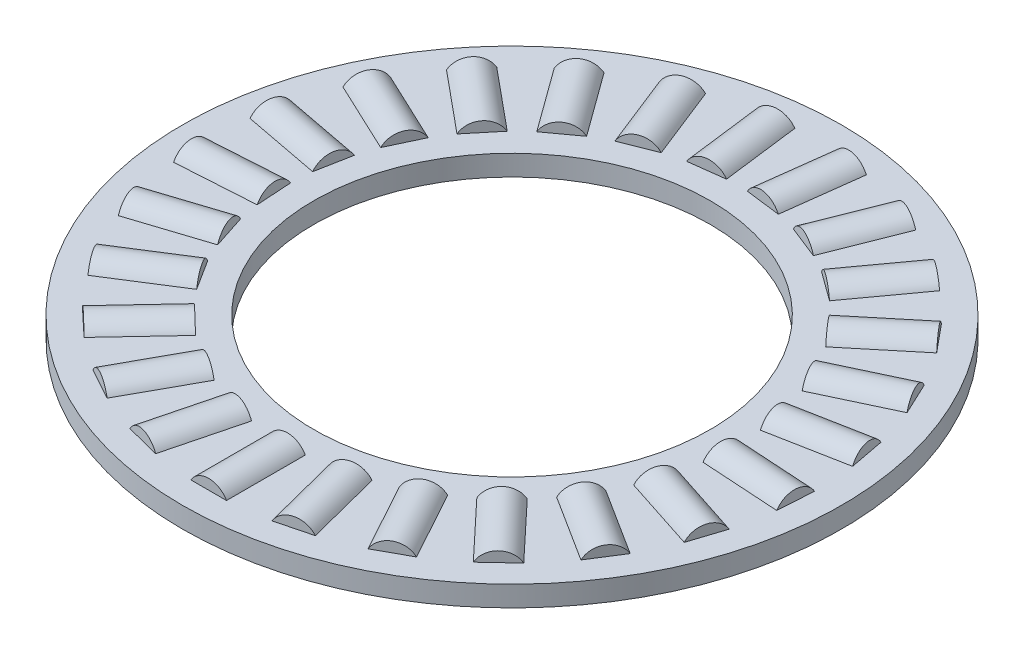
from build123d import *

# Parameters (mm, degrees)
SKETCH5_W         = 6.3246
SKETCH5_H         = 0.9921875
SKETCH3_W         = 3.79476
SKETCH3_H         = 0.9921875
SKETCH2_W         = 3.79476
SKETCH2_H         = 0.9921875
CIRPATTERN1_COUNT = 25
CIRPATTERN1_ANGLE = 345.6
CIRPATTERN2_COUNT = 25


with BuildPart() as part:
    # Sketch5 → Revolve3 (revolve)
    with BuildSketch(Plane(origin=(0, 0, 0), x_dir=(0, 0, -1), z_dir=(1, 0, 0)), mode=Mode.PRIVATE) as revolve3_sk:
        with Locations((-12.7127, 0)):
            Rectangle(SKETCH5_W, SKETCH5_H)
    revolve(revolve3_sk.sketch.rotate(Axis((0, -0.9921875, 0), (0, 1, 0)), 180), axis=Axis((0, -0.9921875, 0), (0, 1, 0)))

    # Sketch3 → Cut-Revolve1 (revolve, cut)
    with BuildSketch(Plane(origin=(0, 0, 0), x_dir=(0, 0, -1), z_dir=(1, 0, 0))):
        with Locations((-12.7127, 0.49609375)):
            Rectangle(SKETCH3_W, SKETCH3_H)
    cut_revolve1 = revolve(axis=Axis((0, 0, 14.61008), (0, 0, -1)), mode=Mode.SUBTRACT)

    # CirPattern2: Cut-Revolve1 ×25 about axis
    cirpattern2_axis = Axis((0, 0, 0), (0, 1, 0))
    for i in range(1, CIRPATTERN2_COUNT):
        add(cut_revolve1.rotate(cirpattern2_axis, i * 360 / CIRPATTERN2_COUNT), mode=Mode.SUBTRACT)


with BuildPart() as body_2:
    # Sketch2 → Revolve2 (revolve)
    with BuildSketch(Plane(origin=(0, 0, 0), x_dir=(0, 0, -1), z_dir=(1, 0, 0)), mode=Mode.PRIVATE) as revolve2_sk:
        with Locations((-12.7127, 0.49609375)):
            Rectangle(SKETCH2_W, SKETCH2_H)
    revolve(revolve2_sk.sketch.rotate(Axis((0, 0, 14.61008), (0, 0, -1)), 90), axis=Axis((0, 0, 14.61008), (0, 0, -1)))


with BuildPart() as cirpattern1_1:
    # CirPattern1: pattern copy
    add(body_2.part.rotate(Axis((0, 0.9921875, 0), (0, -1, 0)), 1 * CIRPATTERN1_ANGLE / (CIRPATTERN1_COUNT - 1)))


with BuildPart() as cirpattern1_2:
    # CirPattern1: pattern copy
    add(body_2.part.rotate(Axis((0, 0.9921875, 0), (0, -1, 0)), 2 * CIRPATTERN1_ANGLE / (CIRPATTERN1_COUNT - 1)))


with BuildPart() as cirpattern1_3:
    # CirPattern1: pattern copy
    add(body_2.part.rotate(Axis((0, 0.9921875, 0), (0, -1, 0)), 3 * CIRPATTERN1_ANGLE / (CIRPATTERN1_COUNT - 1)))


with BuildPart() as cirpattern1_4:
    # CirPattern1: pattern copy
    add(body_2.part.rotate(Axis((0, 0.9921875, 0), (0, -1, 0)), 4 * CIRPATTERN1_ANGLE / (CIRPATTERN1_COUNT - 1)))


with BuildPart() as cirpattern1_5:
    # CirPattern1: pattern copy
    add(body_2.part.rotate(Axis((0, 0.9921875, 0), (0, -1, 0)), 5 * CIRPATTERN1_ANGLE / (CIRPATTERN1_COUNT - 1)))


with BuildPart() as cirpattern1_6:
    # CirPattern1: pattern copy
    add(body_2.part.rotate(Axis((0, 0.9921875, 0), (0, -1, 0)), 6 * CIRPATTERN1_ANGLE / (CIRPATTERN1_COUNT - 1)))


with BuildPart() as cirpattern1_7:
    # CirPattern1: pattern copy
    add(body_2.part.rotate(Axis((0, 0.9921875, 0), (0, -1, 0)), 7 * CIRPATTERN1_ANGLE / (CIRPATTERN1_COUNT - 1)))


with BuildPart() as cirpattern1_8:
    # CirPattern1: pattern copy
    add(body_2.part.rotate(Axis((0, 0.9921875, 0), (0, -1, 0)), 8 * CIRPATTERN1_ANGLE / (CIRPATTERN1_COUNT - 1)))


with BuildPart() as cirpattern1_9:
    # CirPattern1: pattern copy
    add(body_2.part.rotate(Axis((0, 0.9921875, 0), (0, -1, 0)), 9 * CIRPATTERN1_ANGLE / (CIRPATTERN1_COUNT - 1)))


with BuildPart() as cirpattern1_10:
    # CirPattern1: pattern copy
    add(body_2.part.rotate(Axis((0, 0.9921875, 0), (0, -1, 0)), 10 * CIRPATTERN1_ANGLE / (CIRPATTERN1_COUNT - 1)))


with BuildPart() as cirpattern1_11:
    # CirPattern1: pattern copy
    add(body_2.part.rotate(Axis((0, 0.9921875, 0), (0, -1, 0)), 11 * CIRPATTERN1_ANGLE / (CIRPATTERN1_COUNT - 1)))


with BuildPart() as cirpattern1_12:
    # CirPattern1: pattern copy
    add(body_2.part.rotate(Axis((0, 0.9921875, 0), (0, -1, 0)), 12 * CIRPATTERN1_ANGLE / (CIRPATTERN1_COUNT - 1)))


with BuildPart() as cirpattern1_13:
    # CirPattern1: pattern copy
    add(body_2.part.rotate(Axis((0, 0.9921875, 0), (0, -1, 0)), 13 * CIRPATTERN1_ANGLE / (CIRPATTERN1_COUNT - 1)))


with BuildPart() as cirpattern1_14:
    # CirPattern1: pattern copy
    add(body_2.part.rotate(Axis((0, 0.9921875, 0), (0, -1, 0)), 14 * CIRPATTERN1_ANGLE / (CIRPATTERN1_COUNT - 1)))


with BuildPart() as cirpattern1_15:
    # CirPattern1: pattern copy
    add(body_2.part.rotate(Axis((0, 0.9921875, 0), (0, -1, 0)), 15 * CIRPATTERN1_ANGLE / (CIRPATTERN1_COUNT - 1)))


with BuildPart() as cirpattern1_16:
    # CirPattern1: pattern copy
    add(body_2.part.rotate(Axis((0, 0.9921875, 0), (0, -1, 0)), 16 * CIRPATTERN1_ANGLE / (CIRPATTERN1_COUNT - 1)))


with BuildPart() as cirpattern1_17:
    # CirPattern1: pattern copy
    add(body_2.part.rotate(Axis((0, 0.9921875, 0), (0, -1, 0)), 17 * CIRPATTERN1_ANGLE / (CIRPATTERN1_COUNT - 1)))


with BuildPart() as cirpattern1_18:
    # CirPattern1: pattern copy
    add(body_2.part.rotate(Axis((0, 0.9921875, 0), (0, -1, 0)), 18 * CIRPATTERN1_ANGLE / (CIRPATTERN1_COUNT - 1)))


with BuildPart() as cirpattern1_19:
    # CirPattern1: pattern copy
    add(body_2.part.rotate(Axis((0, 0.9921875, 0), (0, -1, 0)), 19 * CIRPATTERN1_ANGLE / (CIRPATTERN1_COUNT - 1)))


with BuildPart() as cirpattern1_20:
    # CirPattern1: pattern copy
    add(body_2.part.rotate(Axis((0, 0.9921875, 0), (0, -1, 0)), 20 * CIRPATTERN1_ANGLE / (CIRPATTERN1_COUNT - 1)))


with BuildPart() as cirpattern1_21:
    # CirPattern1: pattern copy
    add(body_2.part.rotate(Axis((0, 0.9921875, 0), (0, -1, 0)), 21 * CIRPATTERN1_ANGLE / (CIRPATTERN1_COUNT - 1)))


with BuildPart() as cirpattern1_22:
    # CirPattern1: pattern copy
    add(body_2.part.rotate(Axis((0, 0.9921875, 0), (0, -1, 0)), 22 * CIRPATTERN1_ANGLE / (CIRPATTERN1_COUNT - 1)))


with BuildPart() as cirpattern1_23:
    # CirPattern1: pattern copy
    add(body_2.part.rotate(Axis((0, 0.9921875, 0), (0, -1, 0)), 23 * CIRPATTERN1_ANGLE / (CIRPATTERN1_COUNT - 1)))


with BuildPart() as cirpattern1_24:
    # CirPattern1: pattern copy
    add(body_2.part.rotate(Axis((0, 0.9921875, 0), (0, -1, 0)), 24 * CIRPATTERN1_ANGLE / (CIRPATTERN1_COUNT - 1)))


solid = Compound([part.part, body_2.part, cirpattern1_1.part, cirpattern1_2.part, cirpattern1_3.part, cirpattern1_4.part, cirpattern1_5.part, cirpattern1_6.part, cirpattern1_7.part, cirpattern1_8.part, cirpattern1_9.part, cirpattern1_10.part, cirpattern1_11.part, cirpattern1_12.part, cirpattern1_13.part, cirpattern1_14.part, cirpattern1_15.part, cirpattern1_16.part, cirpattern1_17.part, cirpattern1_18.part, cirpattern1_19.part, cirpattern1_20.part, cirpattern1_21.part, cirpattern1_22.part, cirpattern1_23.part, cirpattern1_24.part])
